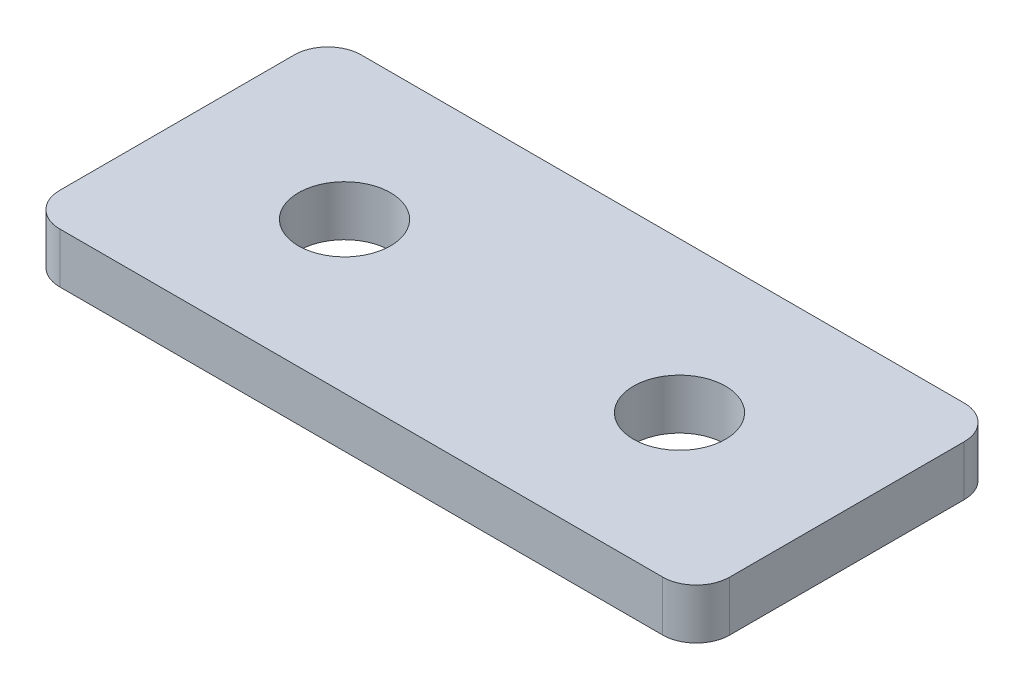
from build123d import *

# Parameters (mm, degrees)
SKETCH_1_R      = 2.75
EXTRUDE_1_DEPTH = 3


with BuildPart() as part:
    # 草图1 → 凸台-拉伸1 (new body)
    with BuildSketch(Plane(origin=(0, 0, 0), x_dir=(1, 0, 0), z_dir=(0, 1, 0))):
        with BuildLine():
            Line((-18, -9), (18, -9))
            ThreePointArc((18, -9), (19.414213562, -8.414213562), (20, -7))
            Line((20, -7), (20, 7))
            ThreePointArc((20, 7), (19.414213562, 8.414213562), (18, 9))
            Line((18, 9), (-18, 9))
            ThreePointArc((-18, 9), (-19.414213562, 8.414213562), (-20, 7))
            Line((-20, 7), (-20, -7))
            ThreePointArc((-20, -7), (-19.414213562, -8.414213562), (-18, -9))
        make_face()
        with Locations(Location((-10, 0, 0), (0, 0, 270))):
            Circle(SKETCH_1_R, mode=Mode.SUBTRACT)
        with Locations(Location((10, 0, 0), (0, 0, 270))):
            Circle(SKETCH_1_R, mode=Mode.SUBTRACT)
    extrude(amount=EXTRUDE_1_DEPTH)


solid = part.part
